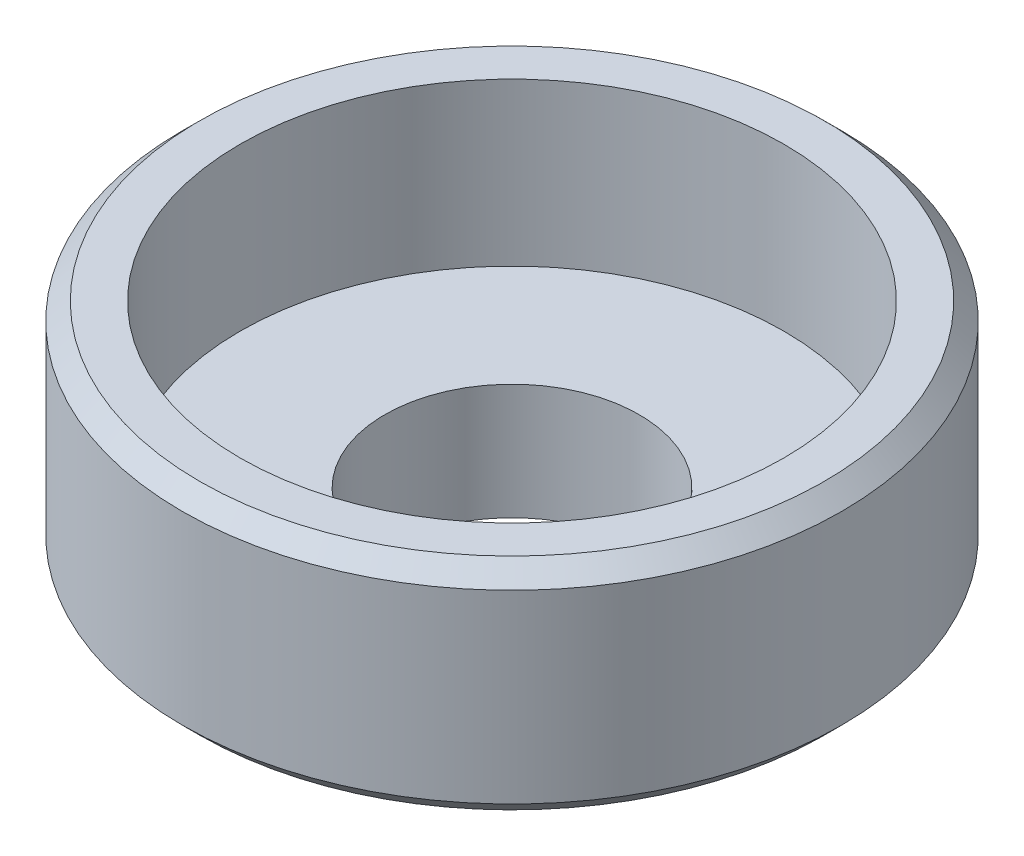
from build123d import *

# Parameters (mm, degrees)
CHAMFER_1_SIZE = 1.5


with BuildPart() as part:
    # Эскиз1 → Повернуть1 (revolve)
    with BuildSketch(Plane(origin=(0, 0, 0), x_dir=(0, 0, -1), z_dir=(1, 0, 0))):
        Polygon((-15, 0), (-28.5, 0), (-28.5, 19), (-23.5, 19), (-23.5, 5), (-11, 5), (-11, -5), (-15, -5), align=None)
    revolve(axis=Axis((0, 19.771159875, 0), (0, -1, 0)))

    # Фаска1
    chamfer_1_edges = [part.edges().sort_by_distance(p)[0] for p in [
        (0, 19, -28.5),
        (0, 0, -28.5),
        (0, -5, -15),
    ]]
    chamfer(chamfer_1_edges, length=CHAMFER_1_SIZE)


solid = part.part
